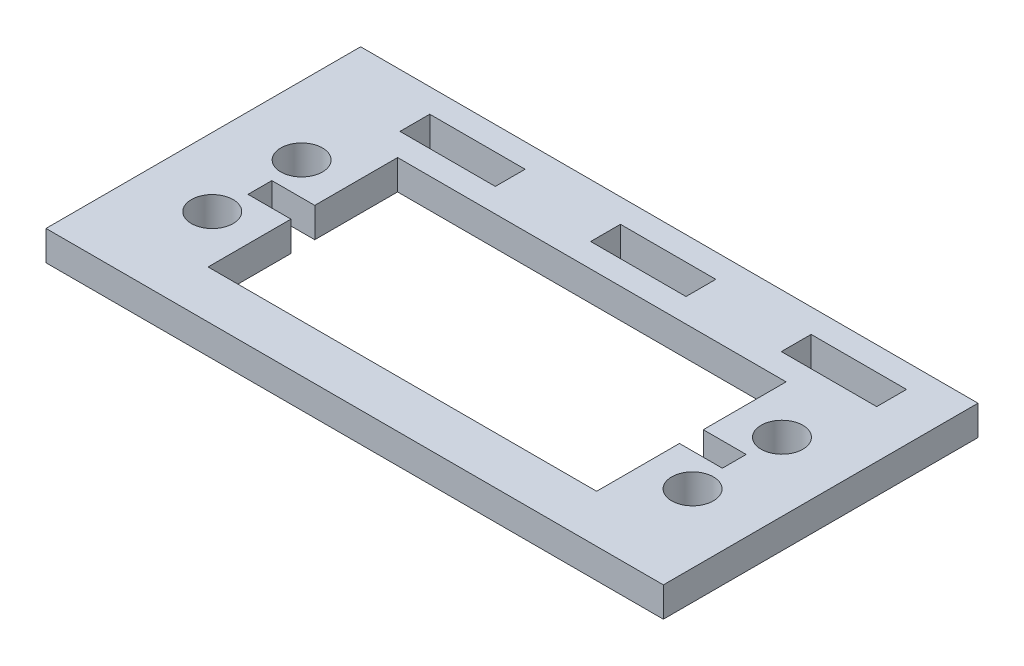
from build123d import *

# Parameters (mm, degrees)
SKETCH1_W           = 65.786
SKETCH1_H           = 33.528
SKETCH1_R           = 2.2225
SKETCH1_W_2         = 10.16
SKETCH1_H_2         = 3.175
BOSS_EXTRUDE2_DEPTH = 3.175


with BuildPart() as part:
    # Sketch1 → Boss-Extrude2 (new body)
    with BuildSketch(Plane(origin=(0, 0, 0), x_dir=(1, 0, 0), z_dir=(0, 1, 0))):
        with Locations((0, 1.5875)):
            Rectangle(SKETCH1_W, SKETCH1_H)
        with Locations(Location((-25.5905, -4.7625, 0), (0, 0, 270))):
            Circle(SKETCH1_R, mode=Mode.SUBTRACT)
        Polygon((20.701, -10.0965), (-20.701, -10.0965), (-20.701, -1.27), (-25.273, -1.27), (-25.273, 1.27), (-20.701, 1.27), (-20.701, 10.0965), (20.701, 10.0965), (20.701, 1.27), (25.273, 1.27), (25.273, -1.27), (20.701, -1.27), align=None, mode=Mode.SUBTRACT)
        with Locations(Location((25.5905, -4.7625, 0), (0, 0, 270))):
            Circle(SKETCH1_R, mode=Mode.SUBTRACT)
        with Locations(Location((-25.5905, 4.7625, 0), (0, 0, 270))):
            Circle(SKETCH1_R, mode=Mode.SUBTRACT)
        with Locations((-17.907, 14.224)):
            Rectangle(SKETCH1_W_2, SKETCH1_H_2, mode=Mode.SUBTRACT)
        with Locations(Location((25.5905, 4.7625, 0), (0, 0, 270))):
            Circle(SKETCH1_R, mode=Mode.SUBTRACT)
        with Locations((2.413, 14.224)):
            Rectangle(SKETCH1_W_2, SKETCH1_H_2, mode=Mode.SUBTRACT)
        with Locations((22.733, 14.224)):
            Rectangle(SKETCH1_W_2, SKETCH1_H_2, mode=Mode.SUBTRACT)
    extrude(amount=BOSS_EXTRUDE2_DEPTH)


solid = part.part
